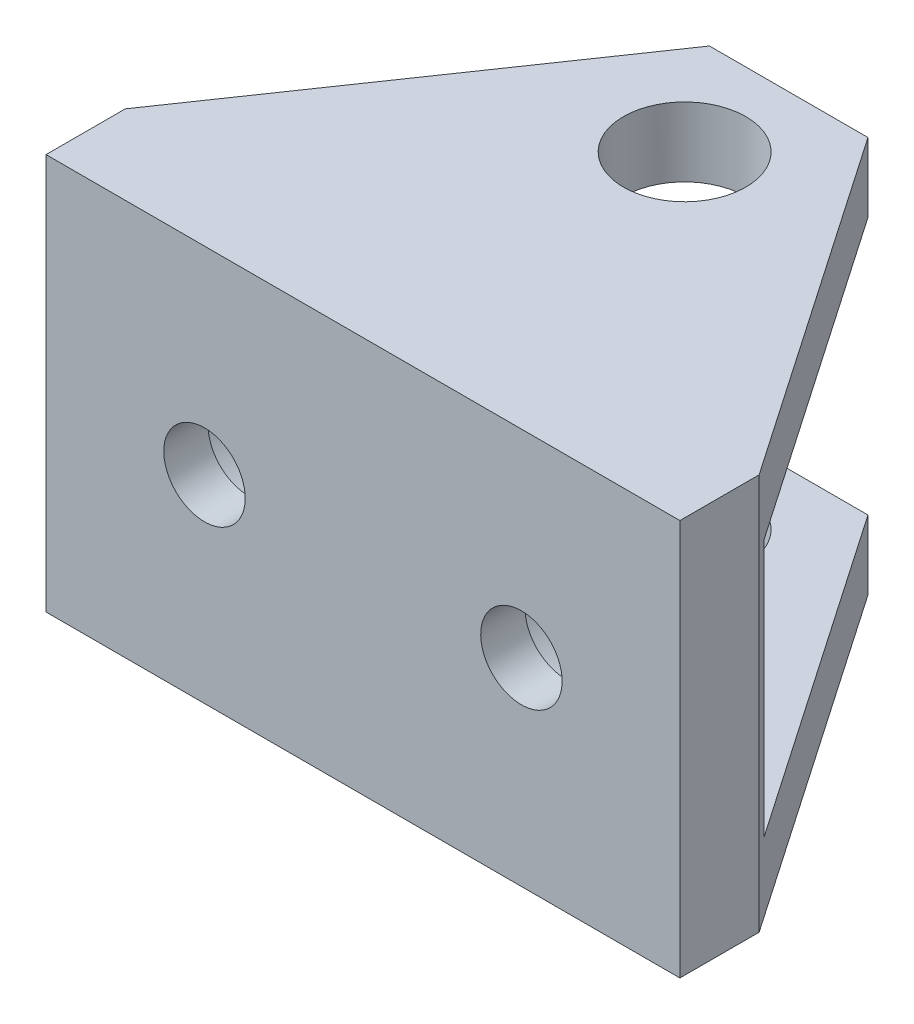
from build123d import *

# Parameters (mm, degrees)
BOSS_EXTRUDE1_DEPTH                                  = 50.8
CBORE_FOR_1_4_BINDING_HEAD_MACHINE_SCREW_D           = 6.5278
CBORE_FOR_1_4_BINDING_HEAD_MACHINE_SCREW_CBORE_D     = 14.2875
CBORE_FOR_1_4_BINDING_HEAD_MACHINE_SCREW_CBORE_DEPTH = 4.064
CUT_EXTRUDE1_REACH                                   = 73.2
SKETCH4_R                                            = 4.9022


with BuildPart() as part:
    # Sketch1 → Boss-Extrude1 (new body)
    with BuildSketch(Plane(origin=(0, 0, 0), x_dir=(0, 0, -1), z_dir=(1, 0, 0))):
        Polygon((0, 0), (0, 31.75), (38.480114202, 31.75), (38.480114202, 26.2001), (7.62, 26.2001), (7.62, 5.5499), (38.480114202, 5.5499), (38.480114202, 0), align=None)
    extrude(amount=BOSS_EXTRUDE1_DEPTH)

    # CBORE for 1/4 Binding Head Machine Screw1 (through all)
    with Locations(Plane(origin=(0, 0, -7.62), x_dir=(-1, 0, 0), z_dir=(0, 0, -1))):
        with Locations((-12.7, 15.875), (-38.1, 15.875)):
            CounterBoreHole(CBORE_FOR_1_4_BINDING_HEAD_MACHINE_SCREW_D / 2, CBORE_FOR_1_4_BINDING_HEAD_MACHINE_SCREW_CBORE_D / 2, CBORE_FOR_1_4_BINDING_HEAD_MACHINE_SCREW_CBORE_DEPTH)

    # Cut-Extrude1: up to this face of the body (flat: up to its plane)
    cut_extrude1_end = Plane(part.part.faces().sort_by_distance((25.4, 31.75, -19.240057101))[0])
    # Sketch4 → Cut-Extrude1 (cut, up to the picked face)
    with BuildSketch(Plane.XZ, mode=Mode.PRIVATE) as cut_extrude1_sk1:
        with Locations(Location((25.4, -25.780114202, 0), (0, 0, 270))):
            Circle(SKETCH4_R)
    cut_extrude1_tool1 = split(extrude(cut_extrude1_sk1.sketch, amount=-CUT_EXTRUDE1_REACH, mode=Mode.PRIVATE), bisect_by=cut_extrude1_end, keep=Keep.BOTH, mode=Mode.PRIVATE)
    # Sketch4 → Cut-Extrude1 (cut, up to the picked face)
    with BuildSketch(Plane.XZ, mode=Mode.PRIVATE) as cut_extrude1_sk2:
        Polygon((19.05, -34.124014202), (0, -6.35), (0, -38.480114202), (50.8, -38.480114202), (50.8, -6.35), (31.75, -34.124014202), align=None)
    cut_extrude1_tool2 = split(extrude(cut_extrude1_sk2.sketch, amount=-CUT_EXTRUDE1_REACH, mode=Mode.PRIVATE), bisect_by=cut_extrude1_end, keep=Keep.BOTH, mode=Mode.PRIVATE)
    add(cut_extrude1_tool1.solids().sort_by(Axis((25.4, 0, -25.780114), (0, 1, 0)))[0], mode=Mode.SUBTRACT)
    add(cut_extrude1_tool2.solids().sort_by(Axis((9.029312, 0, -20.576996), (0, 1, 0)))[0], mode=Mode.SUBTRACT)


solid = part.part
